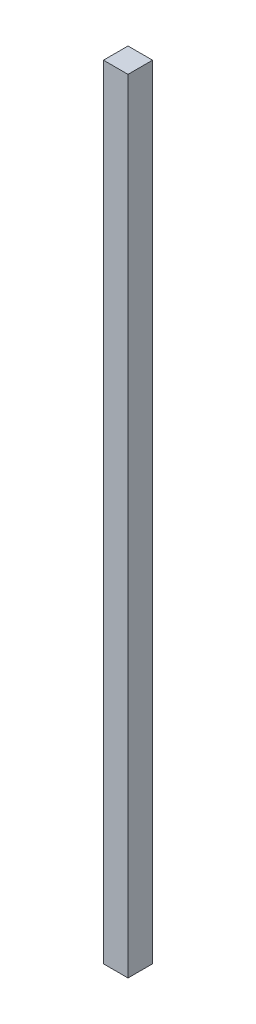
from build123d import *

# Parameters (mm, degrees)
SKETCH1_W           = 20
SKETCH1_H           = 20
BOSS_EXTRUDE1_DEPTH = 637.76


with BuildPart() as part:
    # Sketch1 → Boss-Extrude1 (new body)
    with BuildSketch(Plane(origin=(0, 0, 0), x_dir=(1, 0, 0), z_dir=(0, 1, 0))):
        with Locations((10, -10)):
            Rectangle(SKETCH1_W, SKETCH1_H)
    extrude(amount=BOSS_EXTRUDE1_DEPTH)


solid = part.part
